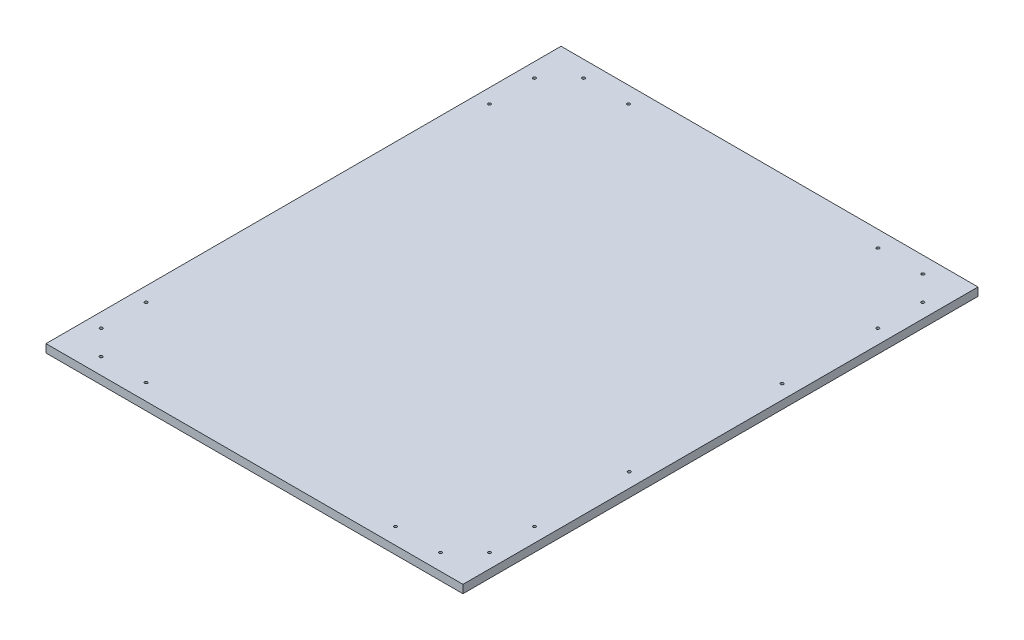
from build123d import *

# Parameters (mm, degrees)
SKETCH1_W           = 510
SKETCH1_H           = 630
BOSS_EXTRUDE1_DEPTH = 10
SKETCH2_R           = 1.8
CUT_EXTRUDE1_DEPTH  = 10
SKETCH3_R           = 1.8
CUT_EXTRUDE2_DEPTH  = 10
SKETCH4_R           = 1.8
CUT_EXTRUDE3_DEPTH  = 12.1


with BuildPart() as part:
    # Sketch1 → Boss-Extrude1 (new body)
    with BuildSketch(Plane(origin=(0, 0, 0), x_dir=(1, 0, 0), z_dir=(0, 1, 0))):
        with Locations((255, 315)):
            Rectangle(SKETCH1_W, SKETCH1_H)
    extrude(amount=BOSS_EXTRUDE1_DEPTH)

    # Sketch2 → Cut-Extrude1 (cut)
    with BuildSketch(Plane(origin=(0, 10, 0), x_dir=(1, 0, 0), z_dir=(0, 1, 0))):
        with Locations(Location((492.5, 50, 0), (0, 0, 270))):
            Circle(SKETCH2_R)
        with Locations(Location((492.5, 105, 0), (0, 0, 270))):
            Circle(SKETCH2_R)
        with Locations(Location((492.5, 580, 0), (0, 0, 270))):
            Circle(SKETCH2_R)
        with Locations(Location((492.5, 525, 0), (0, 0, 270))):
            Circle(SKETCH2_R)
        with Locations(Location((492.5, 407.828802922, 0), (0, 0, 270))):
            Circle(SKETCH2_R)
        with Locations(Location((492.5, 221, 0), (0, 0, 270))):
            Circle(SKETCH2_R)
    extrude(amount=-CUT_EXTRUDE1_DEPTH, mode=Mode.SUBTRACT)

    # Sketch3 → Cut-Extrude2 (cut)
    with BuildSketch(Plane(origin=(0, 10, 0), x_dir=(1, 0, 0), z_dir=(0, 1, 0))):
        with Locations(Location((17.5, 50, 0), (0, 0, 270))):
            Circle(SKETCH3_R)
        with Locations(Location((17.5, 105, 0), (0, 0, 270))):
            Circle(SKETCH3_R)
        with Locations(Location((17.5, 525, 0), (0, 0, 270))):
            Circle(SKETCH3_R)
        with Locations(Location((17.5, 580, 0), (0, 0, 270))):
            Circle(SKETCH3_R)
    extrude(amount=-CUT_EXTRUDE2_DEPTH, mode=Mode.SUBTRACT)

    # Sketch4 → Cut-Extrude3 (cut)
    with BuildSketch(Plane(origin=(0, 10, 0), x_dir=(1, 0, 0), z_dir=(0, 1, 0))):
        with Locations(Location((47.5, 610, 0), (0, 0, 270))):
            Circle(SKETCH4_R)
        with Locations(Location((102.5, 610, 0), (0, 0, 270))):
            Circle(SKETCH4_R)
        with Locations(Location((407.5, 610, 0), (0, 0, 270))):
            Circle(SKETCH4_R)
        with Locations(Location((462.5, 610, 0), (0, 0, 270))):
            Circle(SKETCH4_R)
        with Locations(Location((462.5, 20, 0), (0, 0, 270))):
            Circle(SKETCH4_R)
        with Locations(Location((407.5, 20, 0), (0, 0, 270))):
            Circle(SKETCH4_R)
        with Locations(Location((102.5, 20, 0), (0, 0, 270))):
            Circle(SKETCH4_R)
        with Locations(Location((47.5, 20, 0), (0, 0, 270))):
            Circle(SKETCH4_R)
    extrude(amount=-CUT_EXTRUDE3_DEPTH, mode=Mode.SUBTRACT)


solid = part.part
